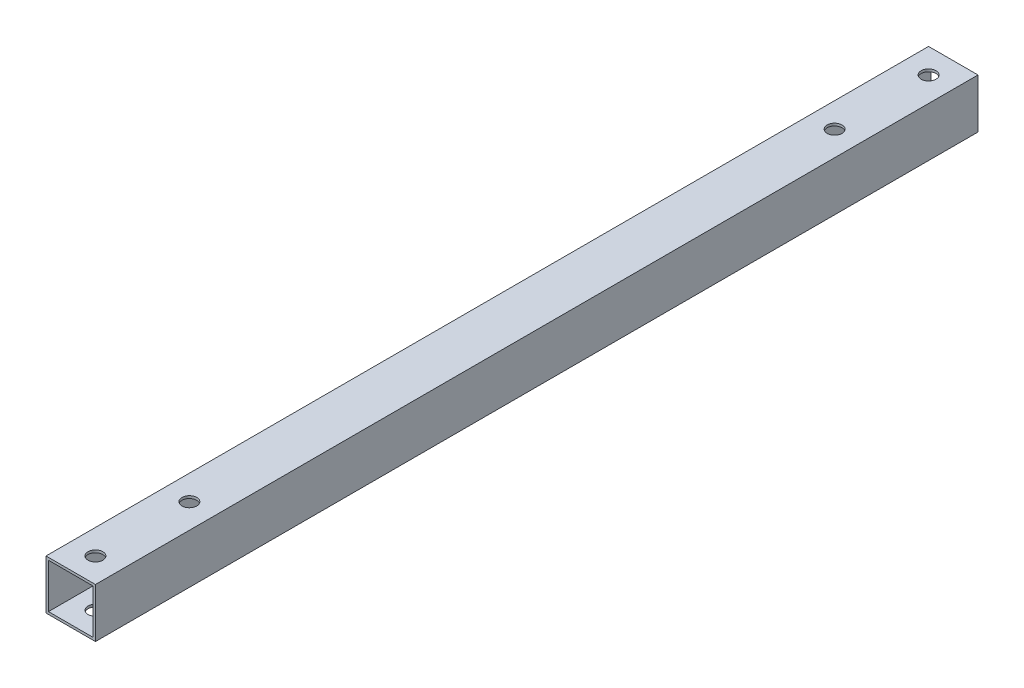
from build123d import *

# Parameters (mm, degrees)
SKETCH_1_W          = 10
SKETCH_1_H          = 10
SKETCH_1_W_2        = 9
SKETCH_1_H_2        = 9
EXTRUDE_1_DEPTH     = 178.5
SKETCH_2_R          = 1.5
CUT_EXTRUDE_1_DEPTH = 179.849797316


with BuildPart() as part:
    # 草圖1 → 填料-伸長1 (new body)
    with BuildSketch(Plane.XY):
        Rectangle(SKETCH_1_W, SKETCH_1_H)
        Rectangle(SKETCH_1_W_2, SKETCH_1_H_2, mode=Mode.SUBTRACT)
    extrude(amount=EXTRUDE_1_DEPTH)

    # 草圖2 → 除料-伸長1 (cut, through all)
    with BuildSketch(Plane(origin=(0, 5, 0), x_dir=(1, 0, 0), z_dir=(0, 1, 0))):
        with Locations(Location((0, -5, 0), (0, 0, 270))):
            Circle(SKETCH_2_R)
        with Locations(Location((0, -24, 0), (0, 0, 270))):
            Circle(SKETCH_2_R)
        with Locations(Location((0, -154.5, 0), (0, 0, 270))):
            Circle(SKETCH_2_R)
        with Locations(Location((0, -173.5, 0), (0, 0, 270))):
            Circle(SKETCH_2_R)
    extrude(amount=-CUT_EXTRUDE_1_DEPTH, mode=Mode.SUBTRACT)


solid = part.part
